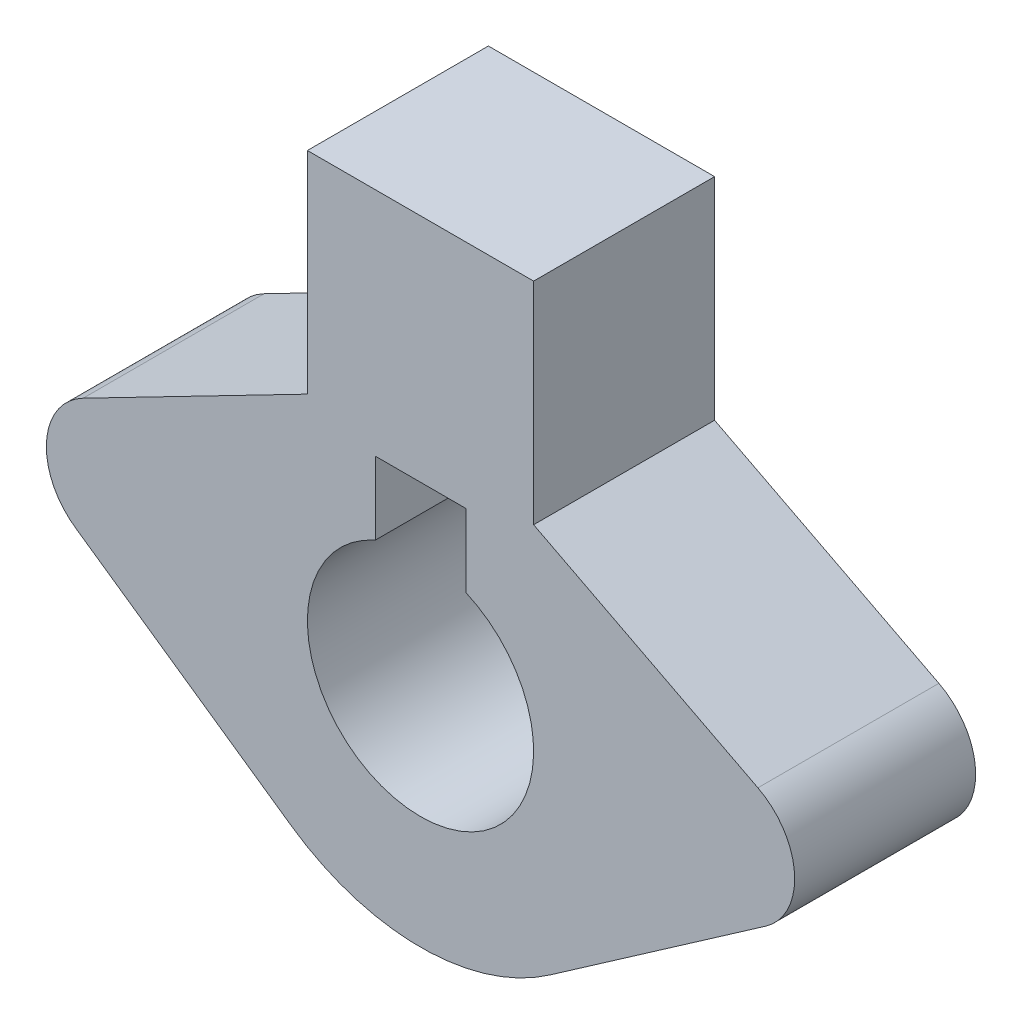
from build123d import *

# Parameters (mm, degrees)
SKETCH1_R           = 5
BOSS_EXTRUDE1_DEPTH = 8
BOSS_EXTRUDE2_DEPTH = 8
FILLET1_R           = 3
SKETCH3_W           = 4
SKETCH3_H           = 4.3
CUT_EXTRUDE1_DEPTH  = 26.720756349


with BuildPart() as part:
    # Sketch1 → Boss-Extrude1 (new body)
    with BuildSketch(Plane.XY):
        with BuildLine():
            Line((-5, 8.660254038), (-5, 18))
            Line((-5, 18), (5, 18))
            Line((5, 18), (5, 8.660254038))
            ThreePointArc((5, 8.660254038), (0, -10), (-5, 8.660254038))
        make_face()
        Circle(SKETCH1_R, mode=Mode.SUBTRACT)
    extrude(amount=BOSS_EXTRUDE1_DEPTH)

    # Sketch2 → Boss-Extrude2 (add)
    with BuildSketch(Plane(origin=(0, 0, 0), x_dir=(-1, 0, 0), z_dir=(0, 0, -1))):
        with BuildLine():
            Line((-5.711537543, -8.208430964), (-19.342239895, 1.275996517))
            Line((-19.342239895, 1.275996517), (-4.583721925, 8.887603351))
            ThreePointArc((-4.583721925, 8.887603351), (-9.978310939, 0.658263473), (-5.711537543, -8.208430964))
        make_face()
        with BuildLine():
            Line((5.711537543, -8.208430964), (19.342239895, 1.275996517))
            Line((19.342239895, 1.275996517), (4.583721925, 8.887603351))
            ThreePointArc((4.583721925, 8.887603351), (9.978310939, 0.658263473), (5.711537543, -8.208430964))
        make_face()
    extrude(amount=-BOSS_EXTRUDE2_DEPTH)

    # Fillet1
    fillet1_edges = [part.edges().sort_by_distance(p)[0] for p in [
        (19.342239895, 1.275996517, 4),
        (-19.342239895, 1.275996517, 4),
    ]]
    fillet(fillet1_edges, radius=FILLET1_R)

    # Sketch3 → Cut-Extrude1 (cut, through all)
    with BuildSketch(Plane(origin=(0, 0, 0), x_dir=(-1, 0, 0), z_dir=(0, 0, -1))):
        with Locations((0, 5.65)):
            Rectangle(SKETCH3_W, SKETCH3_H)
    extrude(amount=-CUT_EXTRUDE1_DEPTH, mode=Mode.SUBTRACT)


solid = part.part
